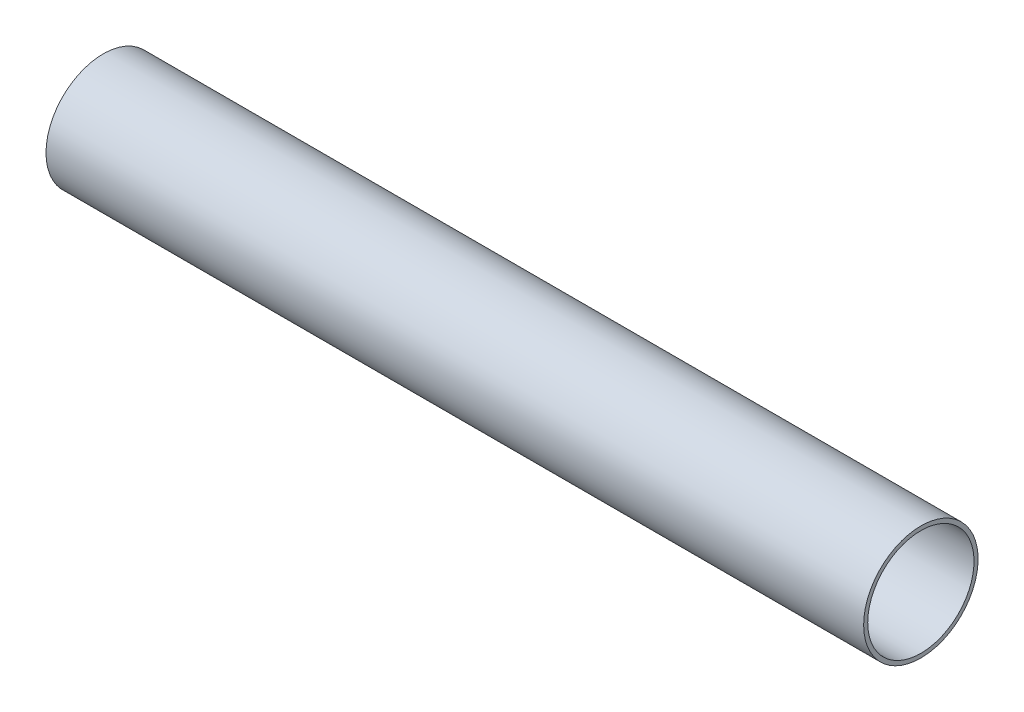
from build123d import *

# Parameters (mm, degrees)
ESQUISSE1_W = 200
ESQUISSE1_H = 1


with BuildPart() as part:
    # Esquisse1 → Base-Révolution (revolve)
    with BuildSketch(Plane.XY, mode=Mode.PRIVATE) as base_r_volution_sk:
        with Locations((100, 13.5)):
            Rectangle(ESQUISSE1_W, ESQUISSE1_H)
    revolve(base_r_volution_sk.sketch.rotate(Axis((0, 0, 0), (1, 0, 0)), 90), axis=Axis((0, 0, 0), (1, 0, 0)))


solid = part.part
